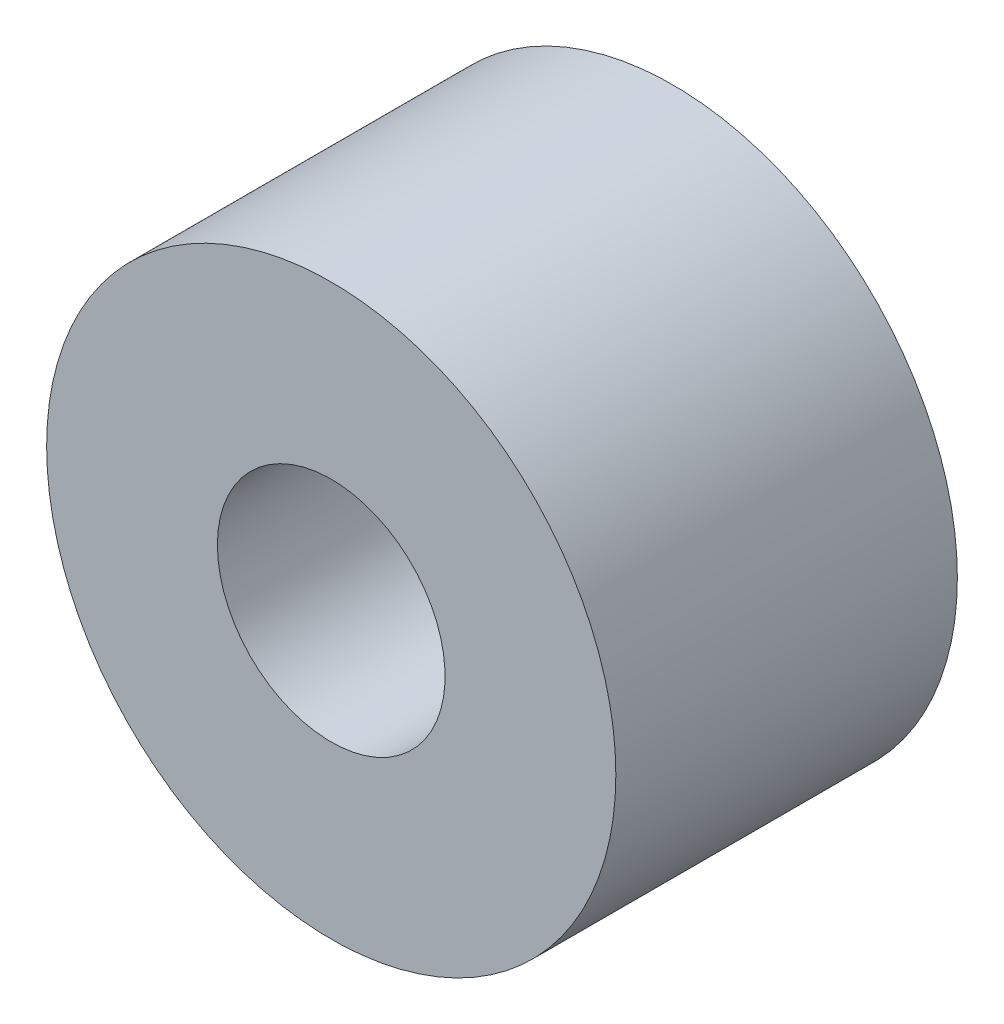
from build123d import *

# Parameters (mm, degrees)
SKETCH_1_R      = 37.5
SKETCH_1_R_2    = 15
EXTRUDE_1_DEPTH = 45


with BuildPart() as part:
    # 草图1 → 凸台-拉伸1 (new body)
    with BuildSketch(Plane.XY):
        with Locations(Location((0, 0, 0), (0, 0, 180))):
            Circle(SKETCH_1_R)
        with Locations(Location((0, 0, 0), (0, 0, 180))):
            Circle(SKETCH_1_R_2, mode=Mode.SUBTRACT)
    extrude(amount=EXTRUDE_1_DEPTH)


solid = part.part
